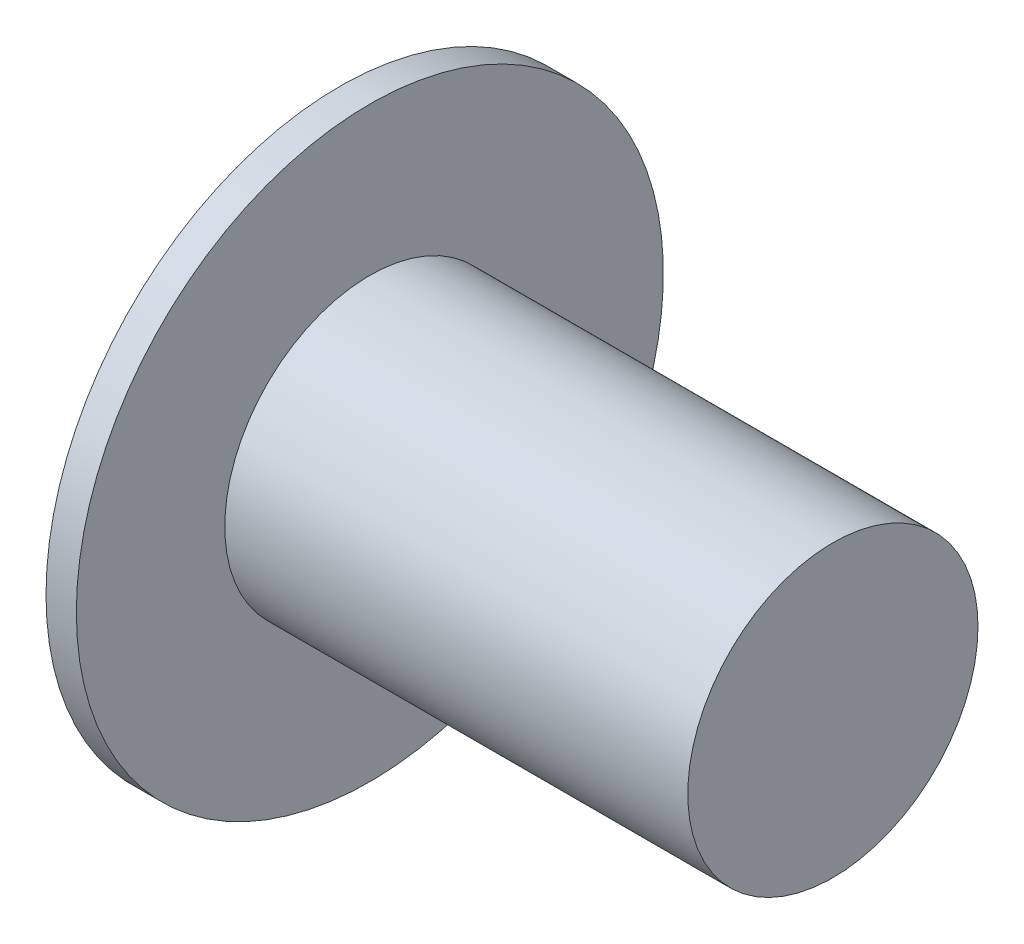
from build123d import *

# Parameters (mm, degrees)
SKETCH2_R           = 11
BOSS_EXTRUDE2_DEPTH = 35.1
SKETCH3_R           = 22.25
BOSS_EXTRUDE3_DEPTH = 2.3
BOSS_EXTRUDE4_START = 5
SKETCH4_R           = 11
BOSS_EXTRUDE4_DEPTH = 5
SKETCH5_R           = 3.9
BOSS_EXTRUDE5_DEPTH = 7.54


with BuildPart() as part:
    # Sketch2 → Boss-Extrude2 (new body)
    with BuildSketch(Plane(origin=(0, 0, 0), x_dir=(0, 0, -1), z_dir=(1, 0, 0))):
        Circle(SKETCH2_R)
    extrude(amount=BOSS_EXTRUDE2_DEPTH)

    # Sketch3 → Boss-Extrude3 (add)
    with BuildSketch(Plane.ZY):
        Circle(SKETCH3_R)
    extrude(amount=BOSS_EXTRUDE3_DEPTH)

    # Sketch4 → Boss-Extrude4 (add)
    with BuildSketch(Plane.ZY.offset(2.3).offset(BOSS_EXTRUDE4_START)):
        with Locations(Location((0, 0, 0), (0, 0, 180))):
            Circle(SKETCH4_R)
    extrude(amount=-BOSS_EXTRUDE4_DEPTH)

    # Sketch5 → Boss-Extrude5 (add)
    with BuildSketch(Plane.ZY.offset(7.3)):
        Circle(SKETCH5_R)
    extrude(amount=BOSS_EXTRUDE5_DEPTH)


solid = part.part
